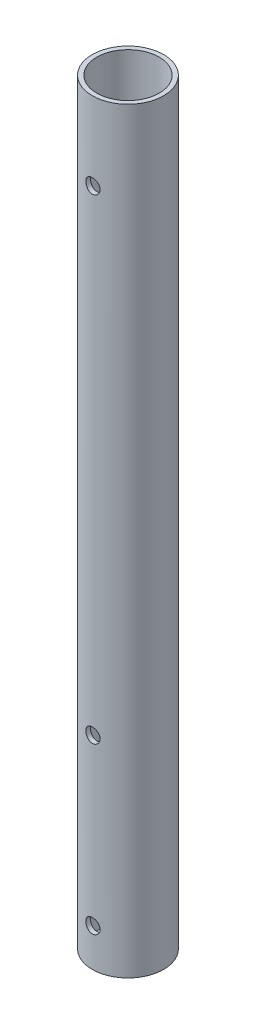
from build123d import *

# Parameters (mm, degrees)
SKETCH_1_R               = 8
SKETCH_1_R_2             = 7
EXTRUDE_1_DEPTH          = 169.65
CUT_EXTRUDE_1_DEPTH      = 171.026828765
CUT_EXTRUDE_1_DEPTH_BACK = 171.026828765
SKETCH_3_R               = 1.6


with BuildPart() as part:
    # 草图1 → 凸台-拉伸1 (new body)
    with BuildSketch(Plane(origin=(0, 0, 0), x_dir=(1, 0, 0), z_dir=(0, 1, 0))):
        with Locations(Location((0, 0, 0), (0, 0, 90))):
            Circle(SKETCH_1_R)
        with Locations(Location((0, 0, 0), (0, 0, 90))):
            Circle(SKETCH_1_R_2, mode=Mode.SUBTRACT)
    extrude(amount=EXTRUDE_1_DEPTH)

    # 草图3 → 切除-拉伸1 (cut, two sides: drawn at the far end of the back side and taken through both)
    with BuildSketch(Plane.XY.offset(-CUT_EXTRUDE_1_DEPTH_BACK)):
        with Locations((0, 152.15)):
            Circle(SKETCH_3_R)
        with Locations((0, 45.5)):
            Circle(SKETCH_3_R)
        with Locations((0, 8.5)):
            Circle(SKETCH_3_R)
    extrude(amount=CUT_EXTRUDE_1_DEPTH + CUT_EXTRUDE_1_DEPTH_BACK, mode=Mode.SUBTRACT)


solid = part.part
